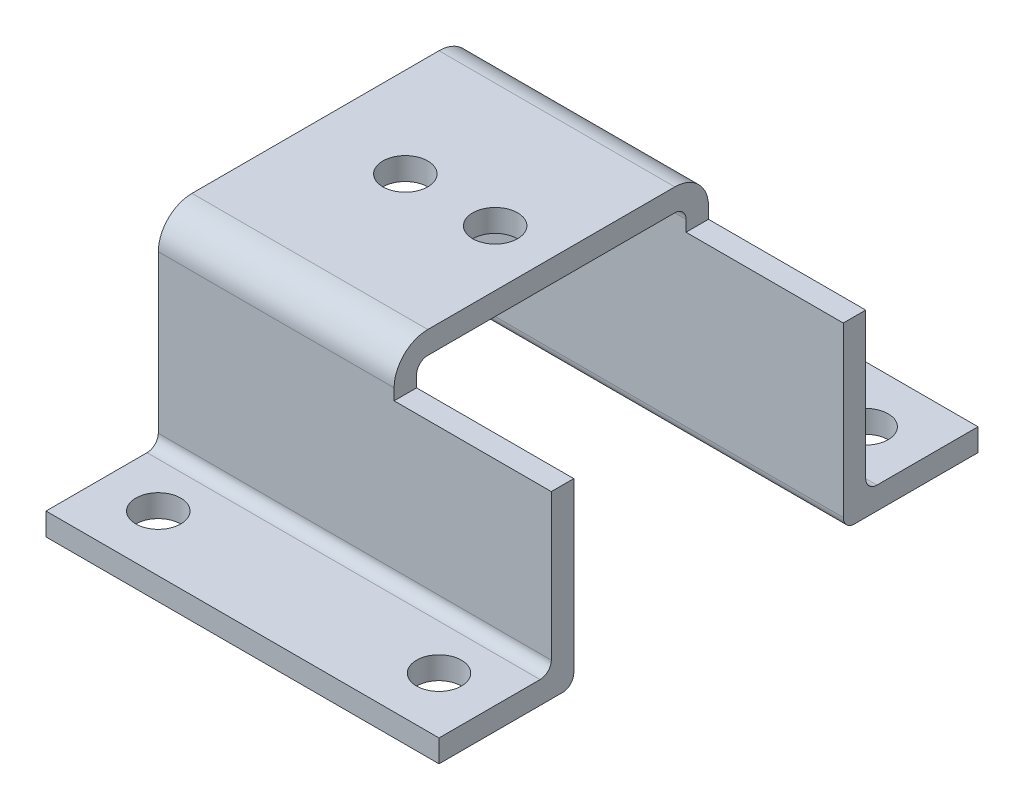
from build123d import *

# Parameters (mm, degrees)
BOSS_EXTRUDE1_DEPTH     = 17.5
CUT_EXTRUDE2_DEPTH      = 63.681735777
CUT_EXTRUDE2_DEPTH_BACK = 14
CUT_EXTRUDE3_DEPTH      = 55.16871791
CUT_EXTRUDE3_DEPTH_BACK = 55.16871791
SKETCH4_R               = 2
CUT_EXTRUDE5_DEPTH      = 55.16871791
CUT_EXTRUDE5_DEPTH_BACK = 55.16871791
SKETCH6_R               = 2


with BuildPart() as part:
    # Sketch1 → Boss-Extrude1 (new, symmetric)
    with BuildSketch(Plane(origin=(0, 0, 0), x_dir=(0, 0, -1), z_dir=(1, 0, 0))):
        with BuildLine():
            Line((0, 0), (11, 0))
            ThreePointArc((11, 0), (11.707106781, 0.292893219), (12, 1))
            Line((12, 1), (12, 17))
            ThreePointArc((12, 17), (12.292893219, 17.707106781), (13, 18))
            Line((13, 18), (35, 18))
            ThreePointArc((35, 18), (35.707106781, 17.707106781), (36, 17))
            Line((36, 17), (36, 1))
            ThreePointArc((36, 1), (36.292893219, 0.292893219), (37, 0))
            Line((37, 0), (48, 0))
            Line((48, 0), (48, 2))
            Line((48, 2), (39, 2))
            ThreePointArc((39, 2), (38.292893219, 2.292893219), (38, 3))
            Line((38, 3), (38, 17))
            ThreePointArc((38, 17), (37.121320344, 19.121320344), (35, 20))
            Line((35, 20), (13, 20))
            ThreePointArc((13, 20), (10.878679656, 19.121320344), (10, 17))
            Line((10, 17), (10, 3))
            ThreePointArc((10, 3), (9.707106781, 2.292893219), (9, 2))
            Line((9, 2), (0, 2))
            Line((0, 2), (0, 0))
        make_face()
    extrude(amount=BOSS_EXTRUDE1_DEPTH, both=True)

    # Sketch3 → Cut-Extrude2 (cut, two sides: drawn at the far end of the back side and taken through both)
    with BuildSketch(Plane(origin=(17.5, 0, 0), x_dir=(0, 0, -1), z_dir=(1, 0, 0)).offset(-CUT_EXTRUDE2_DEPTH_BACK)):
        with BuildLine():
            Line((10, 17), (10, 16))
            Line((10, 16), (12, 16))
            Line((12, 16), (12, 17))
            ThreePointArc((12, 17), (12.292893219, 17.707106781), (13, 18))
            Line((13, 18), (35, 18))
            ThreePointArc((35, 18), (35.707106781, 17.707106781), (36, 17))
            Line((36, 17), (36, 16))
            Line((36, 16), (38, 16))
            Line((38, 16), (38, 17))
            ThreePointArc((38, 17), (37.121320344, 19.121320344), (35, 20))
            Line((35, 20), (13, 20))
            ThreePointArc((13, 20), (10.878679656, 19.121320344), (10, 17))
        make_face()
    extrude(amount=CUT_EXTRUDE2_DEPTH + CUT_EXTRUDE2_DEPTH_BACK, mode=Mode.SUBTRACT)

    # Sketch4 → Cut-Extrude3 (cut, two sides: drawn at the far end of the back side and taken through both)
    with BuildSketch(Plane(origin=(0, 2, 0), x_dir=(1, 0, 0), z_dir=(0, 1, 0)).offset(-CUT_EXTRUDE3_DEPTH_BACK)):
        with Locations(Location((-12.5, 43, 0), (0, 0, 270))):
            Circle(SKETCH4_R)
        with Locations(Location((12.5, 43, 0), (0, 0, 270))):
            Circle(SKETCH4_R)
    extrude(amount=CUT_EXTRUDE3_DEPTH + CUT_EXTRUDE3_DEPTH_BACK, mode=Mode.SUBTRACT)

    # Sketch6 → Cut-Extrude5 (cut, two sides: drawn at the far end of the back side and taken through both)
    with BuildSketch(Plane(origin=(0, 2, 0), x_dir=(1, 0, 0), z_dir=(0, 1, 0)).offset(-CUT_EXTRUDE5_DEPTH_BACK)):
        with Locations(Location((-12.5, 5, 0), (0, 0, 90))):
            Circle(SKETCH6_R)
        with Locations(Location((12.5, 5, 0), (0, 0, 90))):
            Circle(SKETCH6_R)
        with Locations(Location((-9.5, 24, 0), (0, 0, 270))):
            Circle(SKETCH6_R)
        with Locations(Location((-1.5, 24, 0), (0, 0, 270))):
            Circle(SKETCH6_R)
    extrude(amount=CUT_EXTRUDE5_DEPTH + CUT_EXTRUDE5_DEPTH_BACK, mode=Mode.SUBTRACT)


solid = part.part
